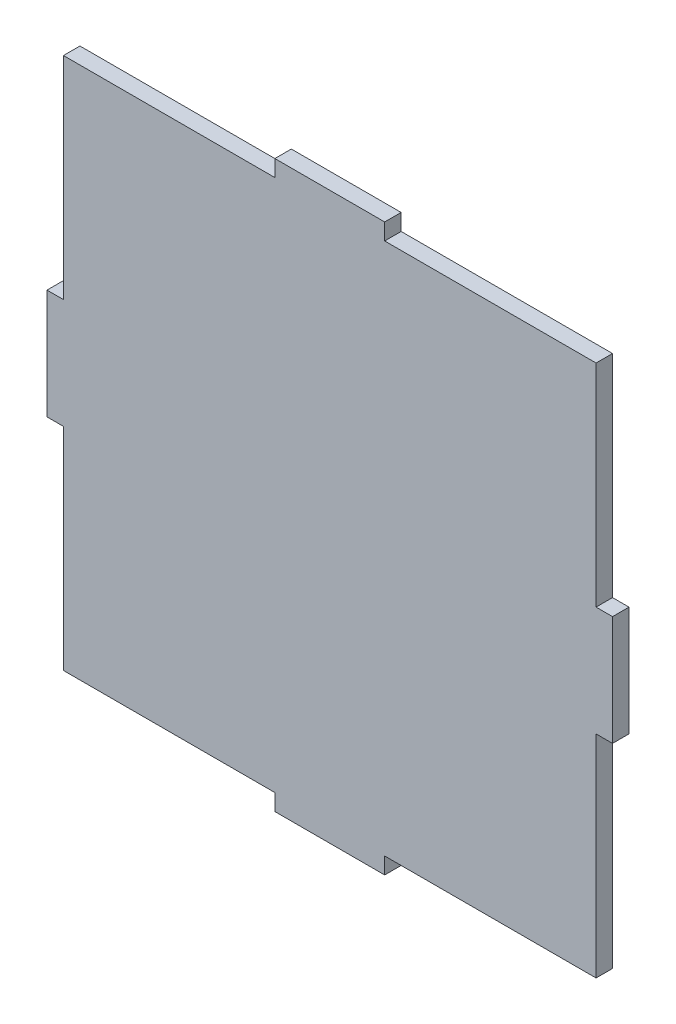
from build123d import *

# Parameters (mm, degrees)
BOSS_EXTRUDE1_DEPTH      = 2
BOSS_EXTRUDE1_DEPTH_BACK = 1


with BuildPart() as part:
    # Sketch1 → Boss-Extrude1 (new, two sides: drawn at the far end of the back side and taken through both)
    with BuildSketch(Plane.XY.offset(-BOSS_EXTRUDE1_DEPTH_BACK)):
        Polygon((98.82804668, 60.344291492), (98.82804668, 98.844291492), (60.32804668, 98.844291492), (60.32804668, 101.844291492), (40.32804668, 101.844291492), (40.32804668, 98.844291492), (1.82804668, 98.844291492), (1.82804668, 60.344291492), (-1.17195332, 60.344291492), (-1.17195332, 40.344291492), (1.82804668, 40.344291492), (1.82804668, 1.844291492), (40.32804668, 1.844291492), (40.32804668, -1.155708508), (60.32804668, -1.155708508), (60.32804668, 1.844291492), (98.82804668, 1.844291492), (98.82804668, 40.344291492), (101.82804668, 40.344291492), (101.82804668, 60.344291492), align=None)
    extrude(amount=BOSS_EXTRUDE1_DEPTH + BOSS_EXTRUDE1_DEPTH_BACK)


solid = part.part
